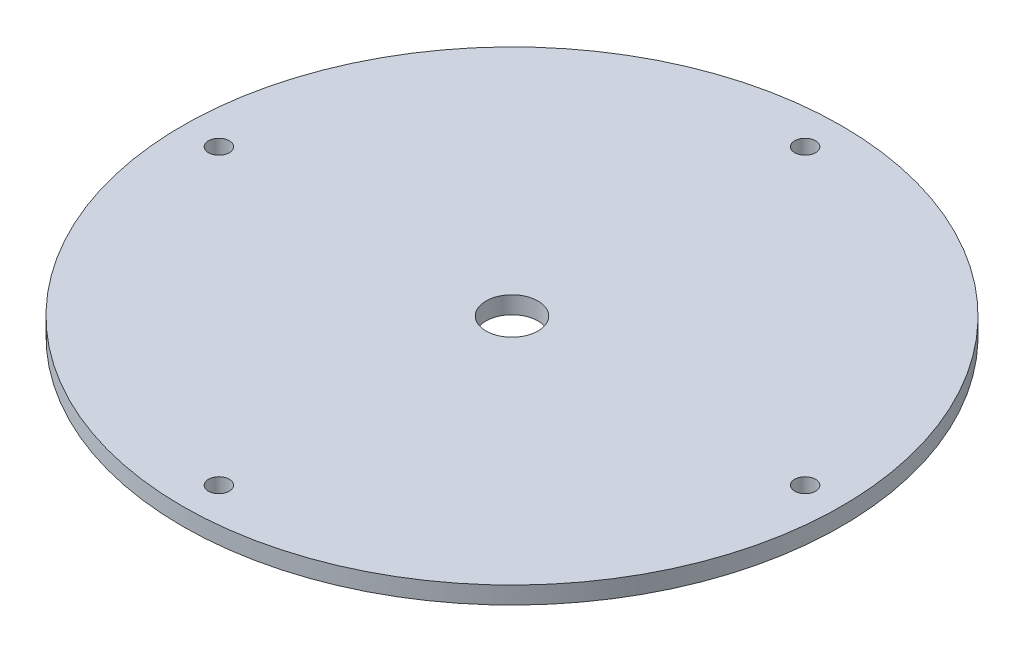
from build123d import *

# Parameters (mm, degrees)
SKETCH2_R           = 95
SKETCH2_R_2         = 7.5
SKETCH2_R_3         = 3
BOSS_EXTRUDE1_DEPTH = 5


with BuildPart() as part:
    # Sketch2 → Boss-Extrude1 (new body)
    with BuildSketch(Plane(origin=(0, 0, 0), x_dir=(1, 0, 0), z_dir=(0, 1, 0))):
        with Locations(Location((0, 0, 0), (0, 0, 270))):
            Circle(SKETCH2_R)
        with Locations(Location((0, 0, 0), (0, 0, 270))):
            Circle(SKETCH2_R_2, mode=Mode.SUBTRACT)
        with Locations(Location((0, 84.5, 0), (0, 0, 270))):
            Circle(SKETCH2_R_3, mode=Mode.SUBTRACT)
        with Locations(Location((84.5, 0, 0), (0, 0, 270))):
            Circle(SKETCH2_R_3, mode=Mode.SUBTRACT)
        with Locations(Location((0, -84.5, 0), (0, 0, 270))):
            Circle(SKETCH2_R_3, mode=Mode.SUBTRACT)
        with Locations(Location((-84.5, 0, 0), (0, 0, 270))):
            Circle(SKETCH2_R_3, mode=Mode.SUBTRACT)
    extrude(amount=BOSS_EXTRUDE1_DEPTH)


solid = part.part
